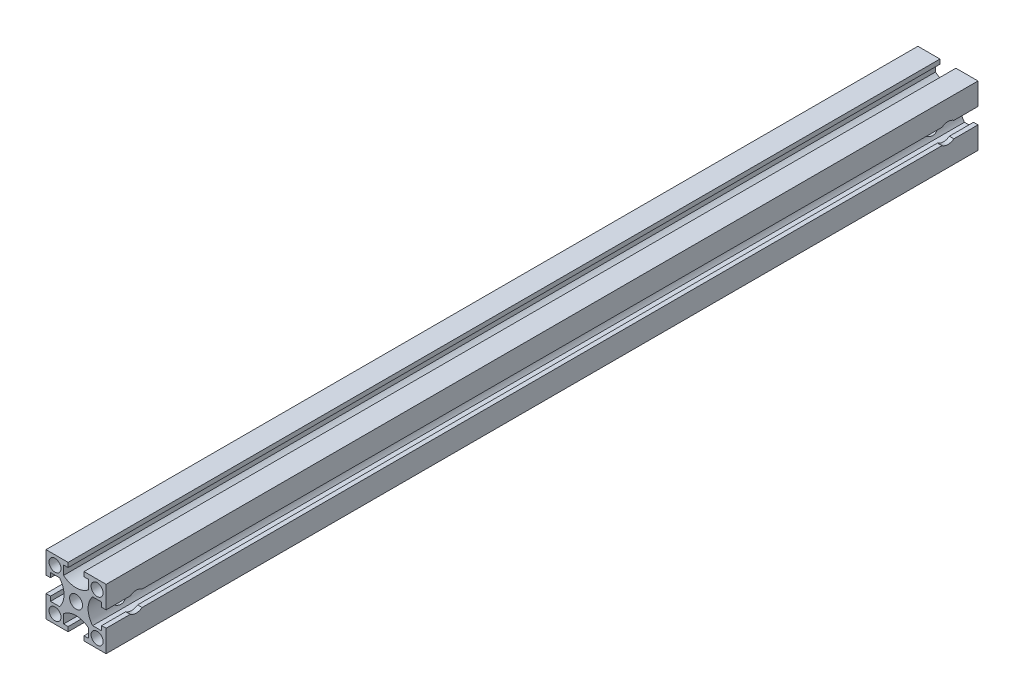
from build123d import *

# Parameters (mm, degrees)
SKETCH_1_W          = 20
SKETCH_1_H          = 20
EXTRUDE_1_DEPTH     = 290
SKETCH_2_R          = 2.15
SKETCH_2_R_2        = 2
CUT_EXTRUDE_1_DEPTH = 291.344622819
HOLE_WIZARD_M6_1_D  = 6.6


with BuildPart() as part:
    # 스케치1 → 보스-돌출1 (new body)
    with BuildSketch(Plane.XY):
        Rectangle(SKETCH_1_W, SKETCH_1_H)
    extrude(amount=EXTRUDE_1_DEPTH)

    # 스케치2 → 컷-돌출1 (cut, through all)
    with BuildSketch(Plane.XY.offset(290)):
        Circle(SKETCH_2_R)
        with Locations((-7, 7)):
            Circle(SKETCH_2_R_2)
        with Locations((7, 7)):
            Circle(SKETCH_2_R_2)
        with Locations((7, -7)):
            Circle(SKETCH_2_R_2)
        with Locations((-7, -7)):
            Circle(SKETCH_2_R_2)
        with BuildLine():
            Line((-2.65, 10), (-2.65, 8.5))
            Line((-2.65, 8.5), (-4.15, 8.5))
            Line((-4.15, 8.5), (-4.15, 5.5))
            ThreePointArc((-4.15, 5.5), (0, 4), (4.15, 5.5))
            Line((4.15, 5.5), (4.15, 8.5))
            Line((4.15, 8.5), (2.65, 8.5))
            Line((2.65, 8.5), (2.65, 10))
            Line((2.65, 10), (-2.65, 10))
        make_face()
        with BuildLine():
            Line((10, 2.65), (8.5, 2.65))
            Line((8.5, 2.65), (8.5, 4.15))
            Line((8.5, 4.15), (5.5, 4.15))
            ThreePointArc((5.5, 4.15), (4, 0), (5.5, -4.15))
            Line((5.5, -4.15), (8.5, -4.15))
            Line((8.5, -4.15), (8.5, -2.65))
            Line((8.5, -2.65), (10, -2.65))
            Line((10, -2.65), (10, 2.65))
        make_face()
        with BuildLine():
            Line((2.65, -10), (2.65, -8.5))
            Line((2.65, -8.5), (4.15, -8.5))
            Line((4.15, -8.5), (4.15, -5.5))
            ThreePointArc((4.15, -5.5), (0, -4), (-4.15, -5.5))
            Line((-4.15, -5.5), (-4.15, -8.5))
            Line((-4.15, -8.5), (-2.65, -8.5))
            Line((-2.65, -8.5), (-2.65, -10))
            Line((-2.65, -10), (2.65, -10))
        make_face()
        with BuildLine():
            Line((-10, -2.65), (-8.5, -2.65))
            Line((-8.5, -2.65), (-8.5, -4.15))
            Line((-8.5, -4.15), (-5.5, -4.15))
            ThreePointArc((-5.5, -4.15), (-4, 0), (-5.5, 4.15))
            Line((-5.5, 4.15), (-8.5, 4.15))
            Line((-8.5, 4.15), (-8.5, 2.65))
            Line((-8.5, 2.65), (-10, 2.65))
            Line((-10, 2.65), (-10, -2.65))
        make_face()
    extrude(amount=-CUT_EXTRUDE_1_DEPTH, mode=Mode.SUBTRACT)

    # M6 여유 구멍1 (through all)
    with Locations(Plane.ZY.offset(10)):
        with Locations((10, 0), (280, 0)):
            Hole(HOLE_WIZARD_M6_1_D / 2)


solid = part.part
